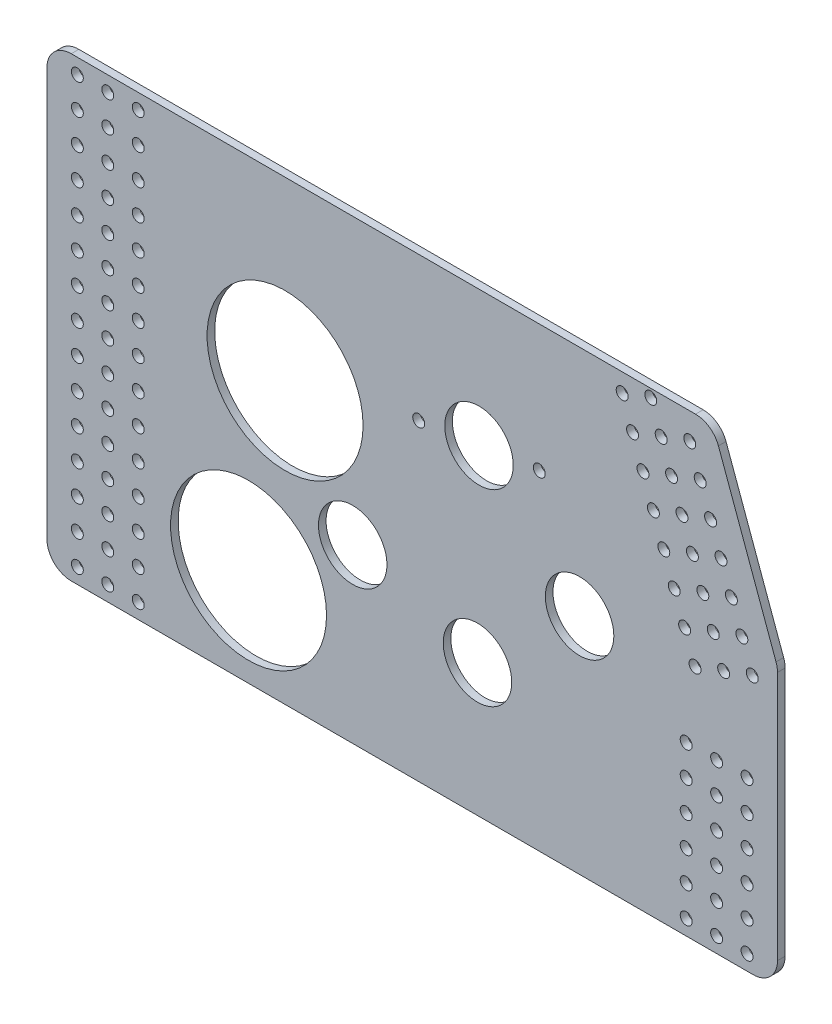
from build123d import *

# Parameters (mm, degrees)
SKETCH1_R           = 2.4892
SKETCH1_R_2         = 14.2875
SKETCH1_R_3         = 29.9974
BOSS_EXTRUDE1_DEPTH = 3.175
BOSS_EXTRUDE2_START = -3.175
SKETCH2_R           = 2.4892
BOSS_EXTRUDE2_DEPTH = 3.175
FILLET1_R           = 10.16
BOSS_EXTRUDE4_START = -3.175
SKETCH7_R           = 14.2875
SKETCH7_R_2         = 2.4892
BOSS_EXTRUDE4_DEPTH = 3.175
SKETCH8_R           = 14.2875
SKETCH8_R_2         = 2.4892
CUT_EXTRUDE1_DEPTH  = 244.979693059
BOSS_EXTRUDE5_START = -3.175
SKETCH11_R          = 29.9974
BOSS_EXTRUDE5_DEPTH = 3.175
SKETCH10_R          = 32.5374
CUT_EXTRUDE2_DEPTH  = 244.979693059


with BuildPart() as part:
    # Sketch1 → Boss-Extrude1 (new body)
    with BuildSketch(Plane.XY):
        Polygon((-152.4, 0), (152.4, 0), (152.4, 116.084254136), (125.314883545, 190.5), (-152.4, 190.5), align=None)
        with Locations((-139.7, 184.15)):
            Circle(SKETCH1_R, mode=Mode.SUBTRACT)
        with Locations((-127, 184.15)):
            Circle(SKETCH1_R, mode=Mode.SUBTRACT)
        with Locations((-114.3, 184.15)):
            Circle(SKETCH1_R, mode=Mode.SUBTRACT)
        with Locations((-127, 171.45)):
            Circle(SKETCH1_R, mode=Mode.SUBTRACT)
        with Locations((-114.3, 171.45)):
            Circle(SKETCH1_R, mode=Mode.SUBTRACT)
        with Locations((-127, 158.75)):
            Circle(SKETCH1_R, mode=Mode.SUBTRACT)
        with Locations((-114.3, 158.75)):
            Circle(SKETCH1_R, mode=Mode.SUBTRACT)
        with Locations((-127, 146.05)):
            Circle(SKETCH1_R, mode=Mode.SUBTRACT)
        with Locations((-114.3, 146.05)):
            Circle(SKETCH1_R, mode=Mode.SUBTRACT)
        with Locations((-127, 133.35)):
            Circle(SKETCH1_R, mode=Mode.SUBTRACT)
        with Locations((-114.3, 133.35)):
            Circle(SKETCH1_R, mode=Mode.SUBTRACT)
        with Locations((-127, 120.65)):
            Circle(SKETCH1_R, mode=Mode.SUBTRACT)
        with Locations((-114.3, 120.65)):
            Circle(SKETCH1_R, mode=Mode.SUBTRACT)
        with Locations((-127, 107.95)):
            Circle(SKETCH1_R, mode=Mode.SUBTRACT)
        with Locations((-114.3, 107.95)):
            Circle(SKETCH1_R, mode=Mode.SUBTRACT)
        with Locations((-127, 95.25)):
            Circle(SKETCH1_R, mode=Mode.SUBTRACT)
        with Locations((-114.3, 95.25)):
            Circle(SKETCH1_R, mode=Mode.SUBTRACT)
        with Locations((-127, 82.55)):
            Circle(SKETCH1_R, mode=Mode.SUBTRACT)
        with Locations((-114.3, 82.55)):
            Circle(SKETCH1_R, mode=Mode.SUBTRACT)
        with Locations((-127, 69.85)):
            Circle(SKETCH1_R, mode=Mode.SUBTRACT)
        with Locations((-114.3, 69.85)):
            Circle(SKETCH1_R, mode=Mode.SUBTRACT)
        with Locations((-127, 57.15)):
            Circle(SKETCH1_R, mode=Mode.SUBTRACT)
        with Locations((-114.3, 57.15)):
            Circle(SKETCH1_R, mode=Mode.SUBTRACT)
        with Locations((-127, 44.45)):
            Circle(SKETCH1_R, mode=Mode.SUBTRACT)
        with Locations((-114.3, 44.45)):
            Circle(SKETCH1_R, mode=Mode.SUBTRACT)
        with Locations((-127, 31.75)):
            Circle(SKETCH1_R, mode=Mode.SUBTRACT)
        with Locations((-114.3, 31.75)):
            Circle(SKETCH1_R, mode=Mode.SUBTRACT)
        with Locations((-127, 19.05)):
            Circle(SKETCH1_R, mode=Mode.SUBTRACT)
        with Locations((-114.3, 19.05)):
            Circle(SKETCH1_R, mode=Mode.SUBTRACT)
        with Locations((-127, 6.35)):
            Circle(SKETCH1_R, mode=Mode.SUBTRACT)
        with Locations((-114.3, 6.35)):
            Circle(SKETCH1_R, mode=Mode.SUBTRACT)
        with Locations((-139.7, 171.45)):
            Circle(SKETCH1_R, mode=Mode.SUBTRACT)
        with Locations((-139.7, 158.75)):
            Circle(SKETCH1_R, mode=Mode.SUBTRACT)
        with Locations((-139.7, 146.05)):
            Circle(SKETCH1_R, mode=Mode.SUBTRACT)
        with Locations((-139.7, 133.35)):
            Circle(SKETCH1_R, mode=Mode.SUBTRACT)
        with Locations((-139.7, 120.65)):
            Circle(SKETCH1_R, mode=Mode.SUBTRACT)
        with Locations((-139.7, 107.95)):
            Circle(SKETCH1_R, mode=Mode.SUBTRACT)
        with Locations((-139.7, 95.25)):
            Circle(SKETCH1_R, mode=Mode.SUBTRACT)
        with Locations((-139.7, 82.55)):
            Circle(SKETCH1_R, mode=Mode.SUBTRACT)
        with Locations((-139.7, 69.85)):
            Circle(SKETCH1_R, mode=Mode.SUBTRACT)
        with Locations((-139.7, 57.15)):
            Circle(SKETCH1_R, mode=Mode.SUBTRACT)
        with Locations((-139.7, 44.45)):
            Circle(SKETCH1_R, mode=Mode.SUBTRACT)
        with Locations((-139.7, 31.75)):
            Circle(SKETCH1_R, mode=Mode.SUBTRACT)
        with Locations((-139.7, 19.05)):
            Circle(SKETCH1_R, mode=Mode.SUBTRACT)
        with Locations((-139.7, 6.35)):
            Circle(SKETCH1_R, mode=Mode.SUBTRACT)
        with Locations((87.590706137, 182.74937795)):
            Circle(SKETCH1_R, mode=Mode.SUBTRACT)
        with Locations((99.524802421, 187.09303377)):
            Circle(SKETCH1_R, mode=Mode.SUBTRACT)
        with Locations((115.802554525, 179.502593307)):
            Circle(SKETCH1_R, mode=Mode.SUBTRACT)
        with Locations((91.934361957, 170.815281666)):
            Circle(SKETCH1_R, mode=Mode.SUBTRACT)
        with Locations((103.868458241, 175.158937486)):
            Circle(SKETCH1_R, mode=Mode.SUBTRACT)
        with Locations((120.146210345, 167.568497023)):
            Circle(SKETCH1_R, mode=Mode.SUBTRACT)
        with Locations((96.278017777, 158.881185382)):
            Circle(SKETCH1_R, mode=Mode.SUBTRACT)
        with Locations((108.212114061, 163.224841202)):
            Circle(SKETCH1_R, mode=Mode.SUBTRACT)
        with Locations((124.489866165, 155.634400739)):
            Circle(SKETCH1_R, mode=Mode.SUBTRACT)
        with Locations((100.621673597, 146.947089098)):
            Circle(SKETCH1_R, mode=Mode.SUBTRACT)
        with Locations((112.555769881, 151.290744918)):
            Circle(SKETCH1_R, mode=Mode.SUBTRACT)
        with Locations((128.833521986, 143.700304455)):
            Circle(SKETCH1_R, mode=Mode.SUBTRACT)
        with Locations((104.965329418, 135.012992814)):
            Circle(SKETCH1_R, mode=Mode.SUBTRACT)
        with Locations((116.899425702, 139.356648634)):
            Circle(SKETCH1_R, mode=Mode.SUBTRACT)
        with Locations((133.177177806, 131.766208171)):
            Circle(SKETCH1_R, mode=Mode.SUBTRACT)
        with Locations((109.308985238, 123.07889653)):
            Circle(SKETCH1_R, mode=Mode.SUBTRACT)
        with Locations((121.243081522, 127.42255235)):
            Circle(SKETCH1_R, mode=Mode.SUBTRACT)
        with Locations((137.520833626, 119.832111887)):
            Circle(SKETCH1_R, mode=Mode.SUBTRACT)
        with Locations((113.652641058, 111.144800246)):
            Circle(SKETCH1_R, mode=Mode.SUBTRACT)
        with Locations((125.586737342, 115.488456066)):
            Circle(SKETCH1_R, mode=Mode.SUBTRACT)
        with Locations((141.864489446, 107.898015603)):
            Circle(SKETCH1_R, mode=Mode.SUBTRACT)
        with Locations((117.996296878, 99.210703962)):
            Circle(SKETCH1_R, mode=Mode.SUBTRACT)
        with Locations((129.930393162, 103.554359782)):
            Circle(SKETCH1_R, mode=Mode.SUBTRACT)
        with Locations((146.208145266, 95.963919319)):
            Circle(SKETCH1_R, mode=Mode.SUBTRACT)
        with Locations((114.3, 69.85)):
            Circle(SKETCH1_R, mode=Mode.SUBTRACT)
        with Locations((127, 69.85)):
            Circle(SKETCH1_R, mode=Mode.SUBTRACT)
        with Locations((139.7, 69.85)):
            Circle(SKETCH1_R, mode=Mode.SUBTRACT)
        with Locations((114.3, 57.15)):
            Circle(SKETCH1_R, mode=Mode.SUBTRACT)
        with Locations((127, 57.15)):
            Circle(SKETCH1_R, mode=Mode.SUBTRACT)
        with Locations((139.7, 57.15)):
            Circle(SKETCH1_R, mode=Mode.SUBTRACT)
        with Locations((114.3, 44.45)):
            Circle(SKETCH1_R, mode=Mode.SUBTRACT)
        with Locations((127, 44.45)):
            Circle(SKETCH1_R, mode=Mode.SUBTRACT)
        with Locations((139.7, 44.45)):
            Circle(SKETCH1_R, mode=Mode.SUBTRACT)
        with Locations((114.3, 31.75)):
            Circle(SKETCH1_R, mode=Mode.SUBTRACT)
        with Locations((127, 31.75)):
            Circle(SKETCH1_R, mode=Mode.SUBTRACT)
        with Locations((139.7, 31.75)):
            Circle(SKETCH1_R, mode=Mode.SUBTRACT)
        with Locations((114.3, 19.05)):
            Circle(SKETCH1_R, mode=Mode.SUBTRACT)
        with Locations((127, 19.05)):
            Circle(SKETCH1_R, mode=Mode.SUBTRACT)
        with Locations((139.7, 19.05)):
            Circle(SKETCH1_R, mode=Mode.SUBTRACT)
        with Locations((114.3, 6.35)):
            Circle(SKETCH1_R, mode=Mode.SUBTRACT)
        with Locations((127, 6.35)):
            Circle(SKETCH1_R, mode=Mode.SUBTRACT)
        with Locations((139.7, 6.35)):
            Circle(SKETCH1_R, mode=Mode.SUBTRACT)
        with Locations((11.850775283, 132.016841695)):
            Circle(SKETCH1_R_2, mode=Mode.SUBTRACT)
        with Locations((-24.819733341, 71.744857423)):
            Circle(SKETCH1_R_2, mode=Mode.SUBTRACT)
        with Locations((57.635078008, 95.712451111)):
            Circle(SKETCH1_R_2, mode=Mode.SUBTRACT)
        with Locations((23.754601626, 49.678686248)):
            Circle(SKETCH1_R_2, mode=Mode.SUBTRACT)
        with Locations((-65.270180641, 36.953448556)):
            Circle(SKETCH1_R_3, mode=Mode.SUBTRACT)
        with Locations((-65.270180641, 106.549448556)):
            Circle(SKETCH1_R_3, mode=Mode.SUBTRACT)
        with Locations((-7.893480799, 147.995713738)):
            Circle(SKETCH1_R, mode=Mode.SUBTRACT)
        with Locations((31.595031365, 116.037969652)):
            Circle(SKETCH1_R, mode=Mode.SUBTRACT)
        with Locations((5.669801626, 80.209486248)):
            Circle(SKETCH1_R, mode=Mode.SUBTRACT)
        with Locations((41.839401626, 80.209486248)):
            Circle(SKETCH1_R, mode=Mode.SUBTRACT)
        with Locations((41.839401626, 19.147886248)):
            Circle(SKETCH1_R, mode=Mode.SUBTRACT)
        with Locations((5.669801626, 19.147886248)):
            Circle(SKETCH1_R, mode=Mode.SUBTRACT)
    extrude(amount=BOSS_EXTRUDE1_DEPTH)

    # Sketch2 → Boss-Extrude2 (add)
    with BuildSketch(Plane.XY.offset(3.175).offset(BOSS_EXTRUDE2_START)):
        with Locations((146.208145266, 95.963919319)):
            Circle(SKETCH2_R)
    extrude(amount=BOSS_EXTRUDE2_DEPTH)

    # Fillet1
    fillet1_edges = [part.edges().sort_by_distance(p)[0] for p in [
        (-152.4, 190.5, 1.5875),
        (125.314883545, 190.5, 1.5875),
        (152.4, 116.084254136, 1.5875),
        (152.4, 0, 1.5875),
        (-152.4, 0, 1.5875),
    ]]
    fillet(fillet1_edges, radius=FILLET1_R)

    # Sketch7 → Boss-Extrude4 (add)
    with BuildSketch(Plane.XY.offset(3.175).offset(BOSS_EXTRUDE4_START)):
        with Locations((11.850775283, 132.016841695)):
            Circle(SKETCH7_R)
        with Locations((57.635078008, 95.712451111)):
            Circle(SKETCH7_R)
        with Locations((23.754601626, 49.678686248)):
            Circle(SKETCH7_R)
        with Locations((41.839401626, 19.147886248)):
            Circle(SKETCH7_R_2)
        with Locations((5.669801626, 19.147886248)):
            Circle(SKETCH7_R_2)
        with Locations((-7.893480799, 147.995713738)):
            Circle(SKETCH7_R_2)
        with Locations((31.595031365, 116.037969652)):
            Circle(SKETCH7_R_2)
        with Locations((41.839401626, 80.209486248)):
            Circle(SKETCH7_R_2)
        with Locations((5.669801626, 80.209486248)):
            Circle(SKETCH7_R_2)
    extrude(amount=BOSS_EXTRUDE4_DEPTH)

    # Sketch8 → Cut-Extrude1 (cut, through all)
    with BuildSketch(Plane.XY.offset(3.175)):
        with Locations((27.23477655, 55.234857423)):
            Circle(SKETCH8_R)
        with Locations((69.831871522, 93.334857423)):
            Circle(SKETCH8_R)
        with Locations((27.864183951, 133.974857423)):
            Circle(SKETCH8_R)
        with Locations((53.016992897, 137.509854188)):
            Circle(SKETCH8_R_2)
        with Locations((2.711375005, 130.439860659)):
            Circle(SKETCH8_R_2)
    extrude(amount=-CUT_EXTRUDE1_DEPTH, mode=Mode.SUBTRACT)

    # Sketch11 → Boss-Extrude5 (add)
    with BuildSketch(Plane.XY.offset(3.175).offset(BOSS_EXTRUDE5_START)):
        with Locations((-65.270180641, 36.953448556)):
            Circle(SKETCH11_R)
        with Locations((-65.270180641, 106.549448556)):
            Circle(SKETCH11_R)
    extrude(amount=BOSS_EXTRUDE5_DEPTH)

    # Sketch10 → Cut-Extrude2 (cut, through all)
    with BuildSketch(Plane.XY.offset(3.175)):
        with Locations((-53.034305174, 117.01177179)):
            Circle(SKETCH10_R)
        with Locations((-68.274305174, 40.81177179)):
            Circle(SKETCH10_R)
    extrude(amount=-CUT_EXTRUDE2_DEPTH, mode=Mode.SUBTRACT)


solid = part.part
